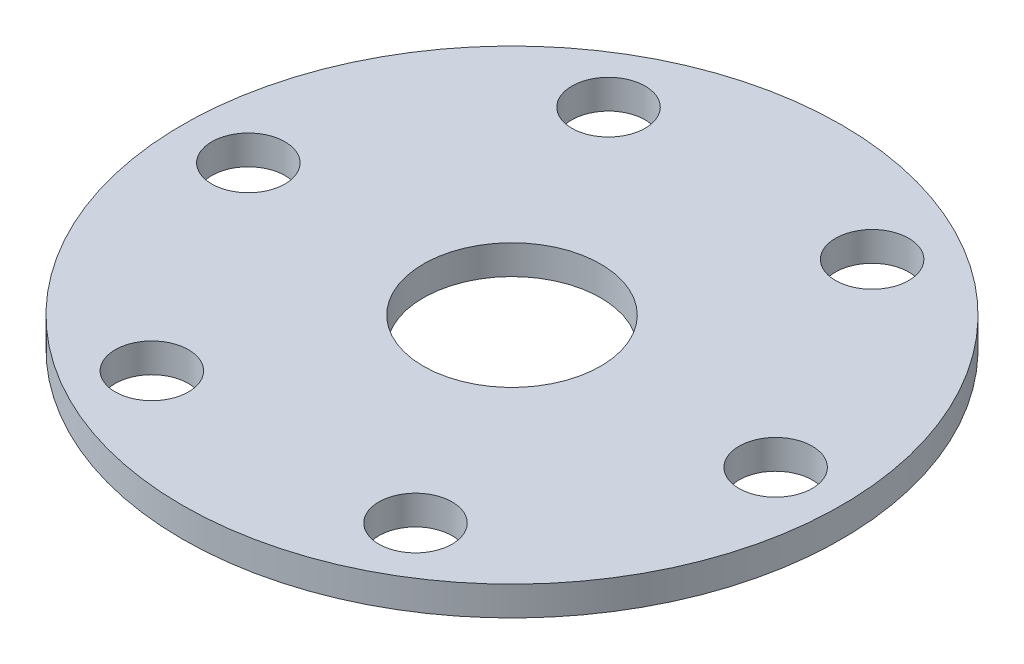
from build123d import *

# Parameters (mm, degrees)
SKETCH2_R           = 22.5
SKETCH2_R_2         = 2.5
BOSS_EXTRUDE1_DEPTH = 2
CUT_EXTRUDE1_REACH  = 33.883
SKETCH3_R           = 6.05


with BuildPart() as part:
    # Sketch2 → Boss-Extrude1 (new body)
    with BuildSketch(Plane(origin=(0, 0, 0), x_dir=(1, 0, 0), z_dir=(0, 1, 0))):
        with Locations(Location((0, 0, 0), (0, 0, 270))):
            Circle(SKETCH2_R)
        with Locations(Location((-18, 0, 0), (0, 0, 270))):
            Circle(SKETCH2_R_2, mode=Mode.SUBTRACT)
        with Locations(Location((-9, 15.588457268, 0), (0, 0, 270))):
            Circle(SKETCH2_R_2, mode=Mode.SUBTRACT)
        with Locations(Location((9, 15.588457268, 0), (0, 0, 270))):
            Circle(SKETCH2_R_2, mode=Mode.SUBTRACT)
        with Locations(Location((18, 0, 0), (0, 0, 270))):
            Circle(SKETCH2_R_2, mode=Mode.SUBTRACT)
        with Locations(Location((9, -15.588457268, 0), (0, 0, 270))):
            Circle(SKETCH2_R_2, mode=Mode.SUBTRACT)
        with Locations(Location((-9, -15.588457268, 0), (0, 0, 270))):
            Circle(SKETCH2_R_2, mode=Mode.SUBTRACT)
    extrude(amount=BOSS_EXTRUDE1_DEPTH)

    # Sketch3 → Cut-Extrude1 (cut, up to next)
    with BuildSketch(Plane(origin=(0, 2, 0), x_dir=(1, 0, 0), z_dir=(0, 1, 0)), mode=Mode.PRIVATE) as cut_extrude1_sk1:
        with Locations(Location((0, 0, 0), (0, 0, 270))):
            Circle(SKETCH3_R)
    cut_extrude1_tool1 = extrude(cut_extrude1_sk1.sketch, amount=-CUT_EXTRUDE1_REACH, mode=Mode.PRIVATE) & part.part
    add(cut_extrude1_tool1.solids().sort_by_distance((0, 2, 0))[0], mode=Mode.SUBTRACT)


solid = part.part
